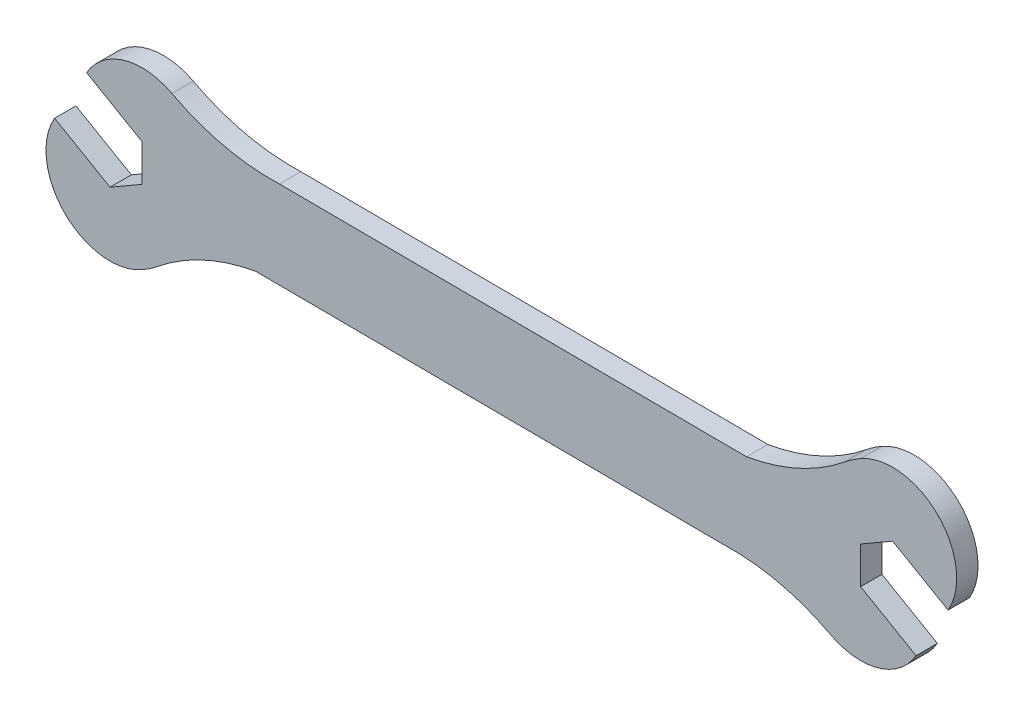
from build123d import *

# Parameters (mm, degrees)
BOSS_EXTRUDE1_DEPTH = 5


with BuildPart() as part:
    # Sketch1 → Boss-Extrude1 (new body)
    with BuildSketch(Plane.XY):
        with BuildLine():
            Line((7.5, 4.330127019), (7.5, -4.330127019))
            Line((7.5, -4.330127019), (0, -8.660254038))
            Line((0, -8.660254038), (-12.990381057, -1.160254038))
            ThreePointArc((-12.990381057, -1.160254038), (-10.606601718, -19.266855756), (7.5, -21.650635095))
            ThreePointArc((7.5, -21.650635095), (9.470749841, -20.408378389), (11.339164993, -19.016946938))
            ThreePointArc((11.339164993, -19.016946938), (22.116918375, -12.378980702), (34.216242145, -8.660254038))
            Line((34.216242145, -8.660254038), (143.609407991, -9.295451439))
            ThreePointArc((143.609407991, -9.295451439), (156.576488353, -10.522513679), (168.786666574, -15.057092233))
            ThreePointArc((168.786666574, -15.057092233), (179.94830651, -16.20923796), (188.786247547, -9.295451439))
            Line((188.786247547, -9.295451439), (175.79586649, -1.795451439))
            Line((175.79586649, -1.795451439), (175.79586649, 6.864802599))
            Line((175.79586649, 6.864802599), (183.29586649, 11.194929618))
            Line((183.29586649, 11.194929618), (196.286247547, 3.694929618))
            ThreePointArc((196.286247547, 3.694929618), (193.902468208, 21.801531335), (175.79586649, 24.185310674))
            ThreePointArc((175.79586649, 24.185310674), (173.82511705, 22.943054244), (171.956702255, 21.55162313))
            ThreePointArc((171.956702255, 21.55162313), (161.178948559, 14.913656483), (149.079624345, 11.194929618))
            Line((149.079624345, 11.194929618), (39.686458499, 11.830127019))
            ThreePointArc((39.686458499, 11.830127019), (26.719378137, 13.057189259), (14.509199916, 17.591767813))
            ThreePointArc((14.509199916, 17.591767813), (3.34755998, 18.74391354), (-5.490381057, 11.830127019))
            Line((-5.490381057, 11.830127019), (7.5, 4.330127019))
        make_face()
    extrude(amount=BOSS_EXTRUDE1_DEPTH)


solid = part.part
